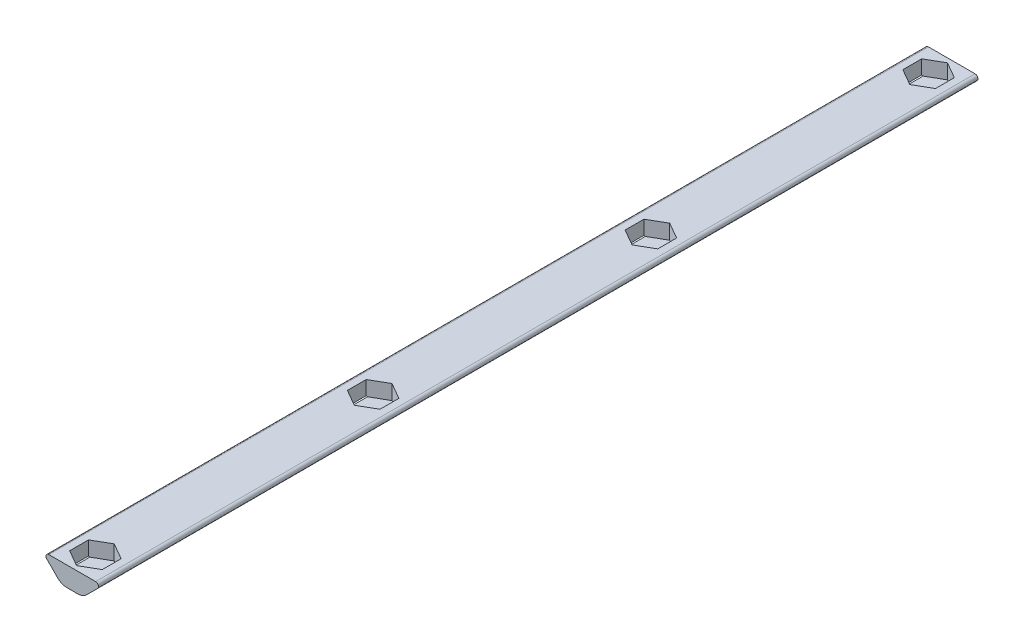
from build123d import *

# Parameters (mm, degrees)
BOSS_EXTRUDE1_DEPTH = 190
CUT_EXTRUDE1_DEPTH  = 3.2


with BuildPart() as part:
    # Sketch1 → Boss-Extrude1 (new body)
    with BuildSketch(Plane(origin=(0, 0, 0), x_dir=(-1, 0, 0), z_dir=(0, 0, 1))):
        with BuildLine():
            Line((-1.134570377, 4.387902266), (1.134570572, 4.387902266))
            ThreePointArc((1.134570572, 4.387902266), (2.22521788, 4.17095913), (3.149824172, 3.553157318))
            Line((3.149824172, 3.553157318), (5.489602344, 1.213380832))
            ThreePointArc((5.489602344, 1.213380832), (5.624633323, 0.534535222), (5.049135806, 0.15))
            Line((5.049135806, 0.15), (-5.049135806, 0.15))
            ThreePointArc((-5.049135806, 0.15), (-5.624631872, 0.534534102), (-5.489601617, 1.213377992))
            Line((-5.489601617, 1.213377992), (-3.149825429, 3.553155866))
            ThreePointArc((-3.149825429, 3.553155866), (-2.225218633, 4.170958737), (-1.134570377, 4.387902266))
        make_face()
    extrude(amount=BOSS_EXTRUDE1_DEPTH)

    # Sketch2 → Cut-Extrude1 (cut)
    with BuildSketch(Plane(origin=(0, -0.15, 0), x_dir=(1, 0, 0), z_dir=(0, 1, 0))):
        Polygon((0, -0.929680602), (-3.525, -2.964840301), (-3.525, -7.035159699), (0, -9.070319398), (3.525, -7.035159699), (3.525, -2.964840301), align=None)
        Polygon((0, -60.929680602), (-3.525, -62.964840301), (-3.525, -67.035159699), (0, -69.070319398), (3.525, -67.035159699), (3.525, -62.964840301), align=None)
        Polygon((0, -120.929680602), (-3.525, -122.964840301), (-3.525, -127.035159699), (0, -129.070319398), (3.525, -127.035159699), (3.525, -122.964840301), align=None)
        Polygon((0, -180.929680602), (-3.525, -182.964840301), (-3.525, -187.035159699), (0, -189.070319398), (3.525, -187.035159699), (3.525, -182.964840301), align=None)
    extrude(amount=-CUT_EXTRUDE1_DEPTH, mode=Mode.SUBTRACT)


solid = part.part
